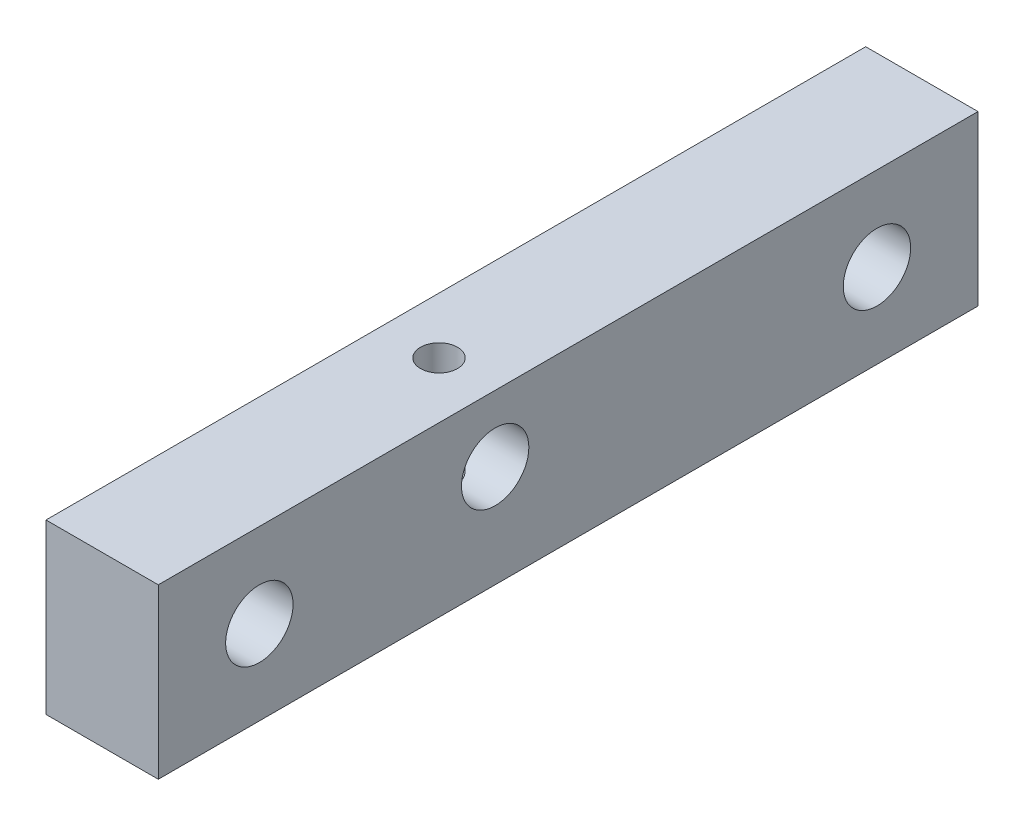
from build123d import *

# Parameters (mm, degrees)
SKETCH1_W                = 10
SKETCH1_H                = 15
BOSS_EXTRUDE1_DEPTH      = 73
F_6_0_6_DIAMETER_HOLE1_D = 6
F_6_0_6_DIAMETER_HOLE2_D = 6
M4X0_7_TAPPED_HOLE1_D    = 3.3


with BuildPart() as part:
    # Sketch1 → Boss-Extrude1 (new body)
    with BuildSketch(Plane.XY):
        Rectangle(SKETCH1_W, SKETCH1_H)
    extrude(amount=-BOSS_EXTRUDE1_DEPTH)

    # Ø6.0 (6) Diameter Hole1 (through all)
    with Locations(Plane(origin=(5, 0, 0), x_dir=(0, 0, -1), z_dir=(1, 0, 0))):
        with Locations((9, 0), (64, 0)):
            Hole(F_6_0_6_DIAMETER_HOLE1_D / 2)

    # Ø6.0 (6) Diameter Hole2 (through all)
    with Locations(Plane(origin=(5, 0, 0), x_dir=(0, 0, -1), z_dir=(1, 0, 0))):
        with Locations((30, 1.6)):
            Hole(F_6_0_6_DIAMETER_HOLE2_D / 2)

    # M4x0.7 Tapped Hole1 (through all)
    with Locations(Plane(origin=(0, 7.5, 0), x_dir=(1, 0, 0), z_dir=(0, 1, 0))):
        with Locations((0, 30)):
            Hole(M4X0_7_TAPPED_HOLE1_D / 2)


solid = part.part
